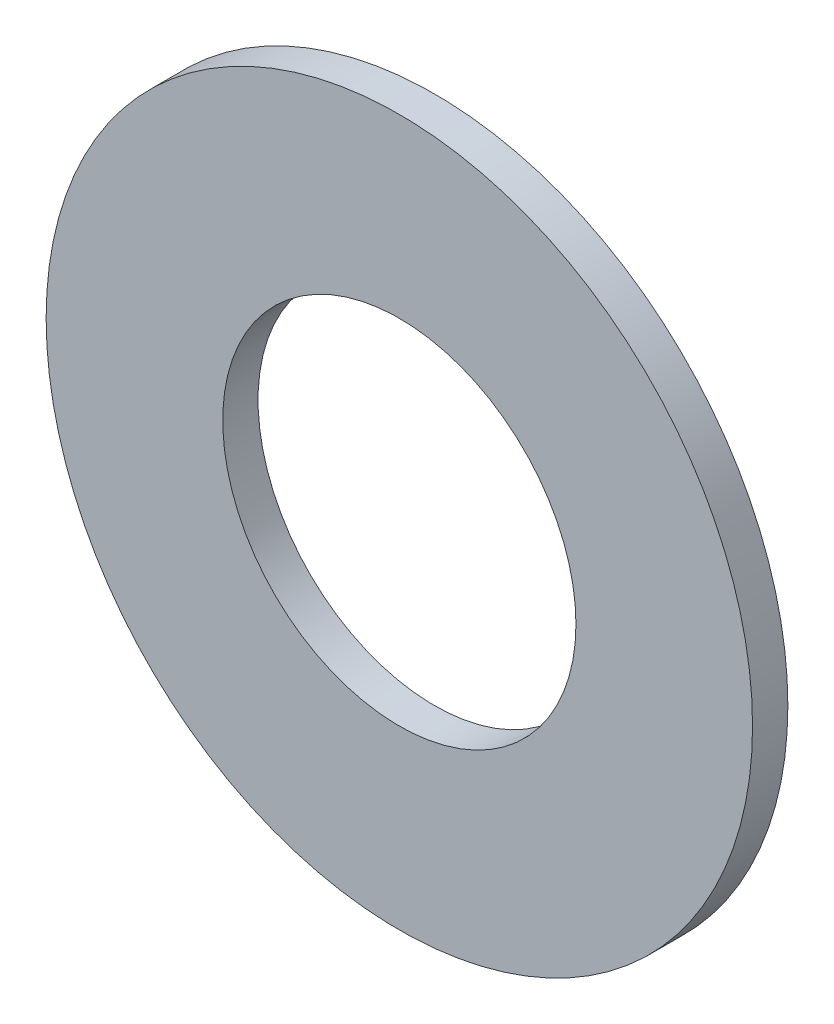
from build123d import *

# Parameters (mm, degrees)
SKETCH_1_R      = 2
SKETCH_1_R_2    = 1
EXTRUDE_1_DEPTH = 0.1


with BuildPart() as part:
    # 草图1 → 凸台-拉伸1 (new, symmetric)
    with BuildSketch(Plane.XY):
        Circle(SKETCH_1_R)
        Circle(SKETCH_1_R_2, mode=Mode.SUBTRACT)
    extrude(amount=EXTRUDE_1_DEPTH, both=True)


solid = part.part
